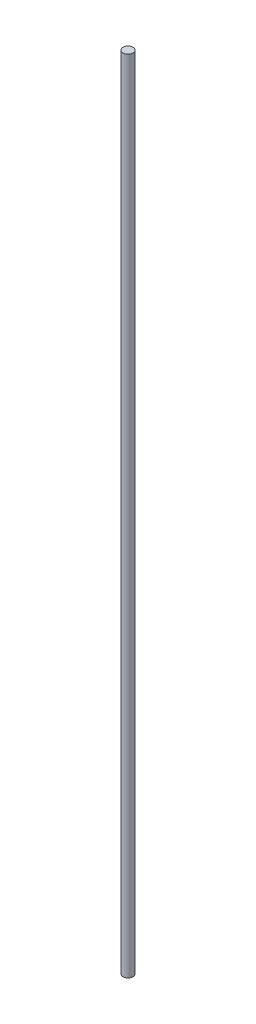
from build123d import *

# Parameters (mm, degrees)
SKETCH1_R           = 1.575
BOSS_EXTRUDE1_DEPTH = 250


with BuildPart() as part:
    # Sketch1 → Boss-Extrude1 (new body)
    with BuildSketch(Plane(origin=(0, 0, 0), x_dir=(1, 0, 0), z_dir=(0, 1, 0))):
        with Locations(Location((0, 0, 0), (0, 0, 270))):
            Circle(SKETCH1_R)
    extrude(amount=BOSS_EXTRUDE1_DEPTH)


solid = part.part
